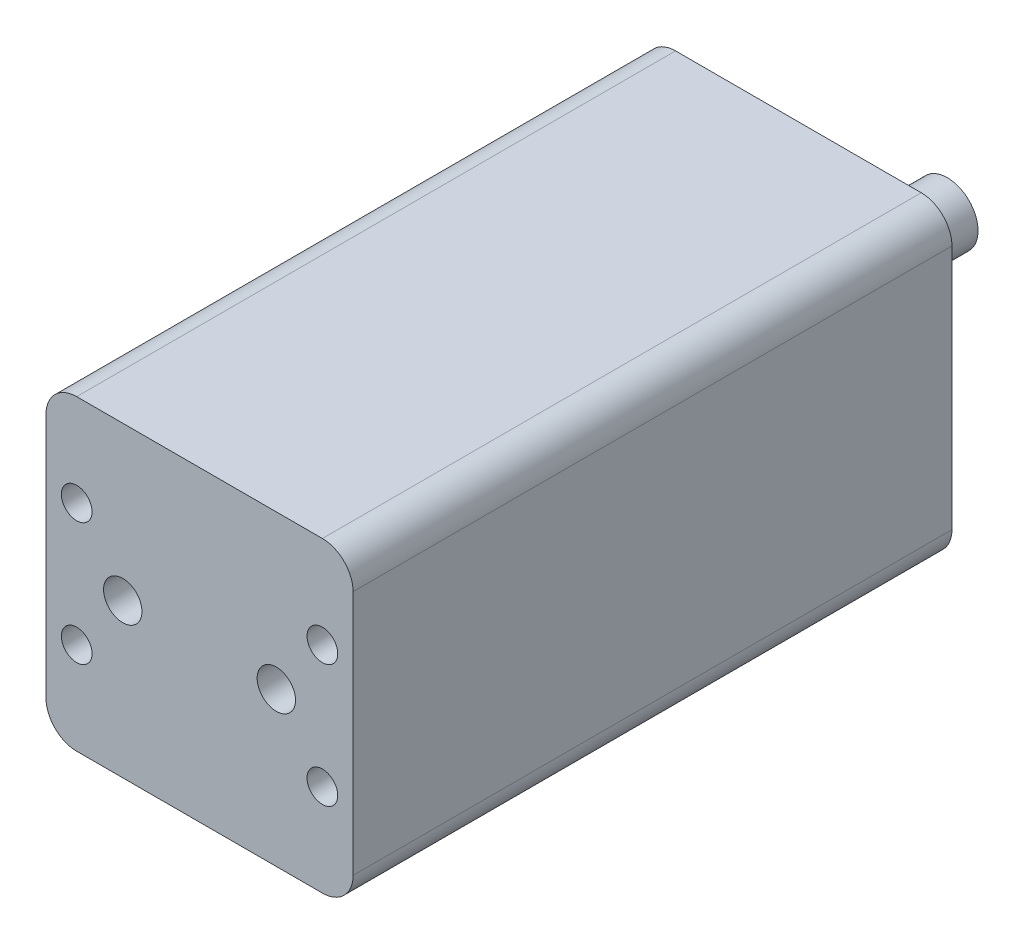
from build123d import *

# Parameters (mm, degrees)
BOSS_EXTRUDE1_DEPTH = 78
SKETCH4_R           = 16
BOSS_EXTRUDE2_DEPTH = 3
SKETCH5_R           = 4
BOSS_EXTRUDE3_DEPTH = 16.4
SKETCH7_R           = 2
CUT_EXTRUDE2_DEPTH  = 9
SKETCH8_R           = 2
CUT_EXTRUDE3_DEPTH  = 10
SKETCH9_R           = 2.5
CUT_EXTRUDE4_DEPTH  = 10


with BuildPart() as part:
    # Sketch3 → Boss-Extrude1 (new body)
    with BuildSketch(Plane.XY):
        with BuildLine():
            Line((-16, -20), (16, -20))
            ThreePointArc((16, -20), (18.828427125, -18.828427125), (20, -16))
            Line((20, -16), (20, 16))
            ThreePointArc((20, 16), (18.828427125, 18.828427125), (16, 20))
            Line((16, 20), (-16, 20))
            ThreePointArc((-16, 20), (-18.828427125, 18.828427125), (-20, 16))
            Line((-20, 16), (-20, -16))
            ThreePointArc((-20, -16), (-18.828427125, -18.828427125), (-16, -20))
        make_face()
    extrude(amount=BOSS_EXTRUDE1_DEPTH)

    # Sketch4 → Boss-Extrude2 (add)
    with BuildSketch(Plane(origin=(0, 0, 0), x_dir=(-1, 0, 0), z_dir=(0, 0, -1))):
        Circle(SKETCH4_R)
    extrude(amount=BOSS_EXTRUDE2_DEPTH)

    # Sketch5 → Boss-Extrude3 (add)
    with BuildSketch(Plane(origin=(0, 0, -3), x_dir=(-1, 0, 0), z_dir=(0, 0, -1))):
        Circle(SKETCH5_R)
    extrude(amount=BOSS_EXTRUDE3_DEPTH)

    # Sketch7 → Cut-Extrude2 (cut)
    with BuildSketch(Plane(origin=(0, 0, 0), x_dir=(-1, 0, 0), z_dir=(0, 0, -1))):
        with Locations((-15.5, 15.5)):
            Circle(SKETCH7_R)
        with Locations((15.5, 15.5)):
            Circle(SKETCH7_R)
        with Locations((15.5, -15.5)):
            Circle(SKETCH7_R)
        with Locations((-15.5, -15.5)):
            Circle(SKETCH7_R)
    extrude(amount=-CUT_EXTRUDE2_DEPTH, mode=Mode.SUBTRACT)

    # Sketch8 → Cut-Extrude3 (cut)
    with BuildSketch(Plane.XY.offset(78)):
        with Locations((-16, 8)):
            Circle(SKETCH8_R)
        with Locations(Location((16, 8, 0), (0, 0, 180))):
            Circle(SKETCH8_R)
        with Locations(Location((-16, -8, 0), (0, 0, 180))):
            Circle(SKETCH8_R)
        with Locations((16, -8)):
            Circle(SKETCH8_R)
    extrude(amount=-CUT_EXTRUDE3_DEPTH, mode=Mode.SUBTRACT)

    # Sketch9 → Cut-Extrude4 (cut)
    with BuildSketch(Plane.XY.offset(78)):
        with Locations((10, 0)):
            Circle(SKETCH9_R)
        with Locations(Location((-10, 0, 0), (0, 0, 180))):
            Circle(SKETCH9_R)
    extrude(amount=-CUT_EXTRUDE4_DEPTH, mode=Mode.SUBTRACT)


solid = part.part
